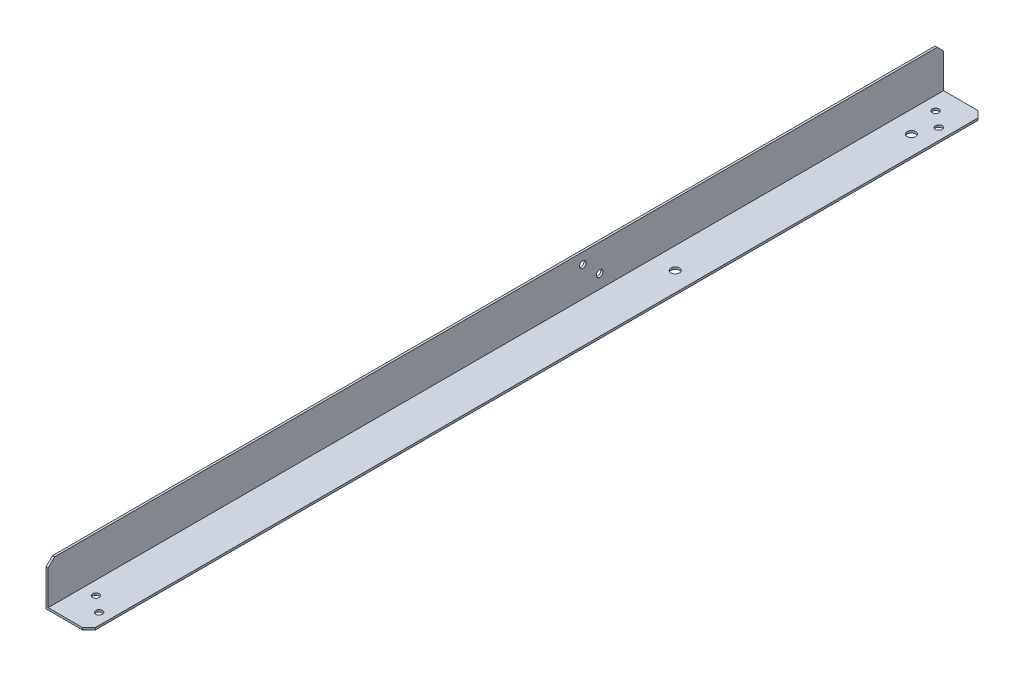
from build123d import *

# Parameters (mm, degrees)
BASE_DEPTH          = 417
CHAMFER1_SIZE       = 3
SKETCH3_R           = 1.55
FORCABLECHAIN_DEPTH = 10
SKETCH4_R           = 1.55
GUIDEHOLES_DEPTH    = 418.958131874
SKETCH5_R           = 2
CABLETIEHOLES_DEPTH = 418.958131874


with BuildPart() as part:
    # Sketch1 → Base (new body)
    with BuildSketch(Plane.XY):
        Polygon((0, 0), (20, 0), (20, 1), (1, 1), (1, 20), (0, 20), align=None)
    extrude(amount=BASE_DEPTH)

    # Chamfer1
    chamfer1_edges = [part.edges().sort_by_distance(p)[0] for p in [
        (20, 0.5, 417),
        (0.5, 20, 417),
        (0.5, 20, 0),
        (20, 0.5, 0),
    ]]
    chamfer(chamfer1_edges, length=CHAMFER1_SIZE)

    # Sketch3 → ForCableChain (cut)
    with BuildSketch(Plane(origin=(1, 0, 0), x_dir=(0, 0, -1), z_dir=(1, 0, 0))):
        with Locations(Location((-168, 14.85, 0), (0, 0, 90))):
            Circle(SKETCH3_R)
        with Locations(Location((-160.2, 7.35, 0), (0, 0, 90))):
            Circle(SKETCH3_R)
    extrude(amount=-FORCABLECHAIN_DEPTH, mode=Mode.SUBTRACT)

    # Sketch4 → GuideHoles (cut, through all)
    with BuildSketch(Plane.XZ):
        with Locations(Location((7.25, 10, 0), (0, 0, 270))):
            Circle(SKETCH4_R)
        with Locations(Location((14.75, 16, 0), (0, 0, 270))):
            Circle(SKETCH4_R)
        with Locations(Location((7.25, 401, 0), (0, 0, 270))):
            Circle(SKETCH4_R)
        with Locations(Location((14.75, 407, 0), (0, 0, 270))):
            Circle(SKETCH4_R)
    extrude(amount=-GUIDEHOLES_DEPTH, mode=Mode.SUBTRACT)

    # Sketch5 → CableTieHoles (cut, through all)
    with BuildSketch(Plane.XZ):
        with Locations(Location((11, 25, 0), (0, 0, 270))):
            Circle(SKETCH5_R)
        with Locations(Location((11, 135, 0), (0, 0, 270))):
            Circle(SKETCH5_R)
    extrude(amount=-CABLETIEHOLES_DEPTH, mode=Mode.SUBTRACT)


solid = part.part
